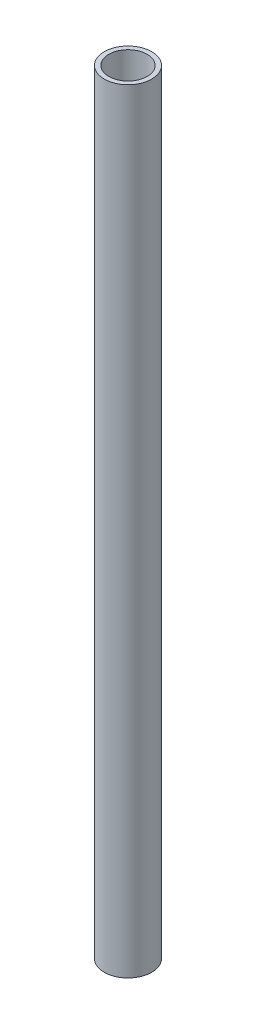
from build123d import *

# Parameters (mm, degrees)
SKETCH1_R           = 12.7
BOSS_EXTRUDE1_DEPTH = 414.02
SHELL1_T            = -2.413
SKETCH2_R           = 10.287
CUT_EXTRUDE1_DEPTH  = 412.998668018


with BuildPart() as part:
    # Sketch1 → Boss-Extrude1 (new body)
    with BuildSketch(Plane(origin=(0, 0, 0), x_dir=(1, 0, 0), z_dir=(0, 1, 0))):
        with Locations(Location((0, 0, 0), (0, 0, 270))):
            Circle(SKETCH1_R)
    extrude(amount=BOSS_EXTRUDE1_DEPTH)

    # Shell1
    shell1_openings = [part.faces().sort_by_distance(p)[0] for p in [
        (0, 414.02, 0),
    ]]
    offset(amount=SHELL1_T, openings=shell1_openings, kind=Kind.INTERSECTION)

    # Sketch2 → Cut-Extrude1 (cut, through all)
    with BuildSketch(Plane(origin=(0, 2.413, 0), x_dir=(1, 0, 0), z_dir=(0, 1, 0))):
        with Locations(Location((0, 0, 0), (0, 0, 270))):
            Circle(SKETCH2_R)
    extrude(amount=-CUT_EXTRUDE1_DEPTH, mode=Mode.SUBTRACT)


solid = part.part
